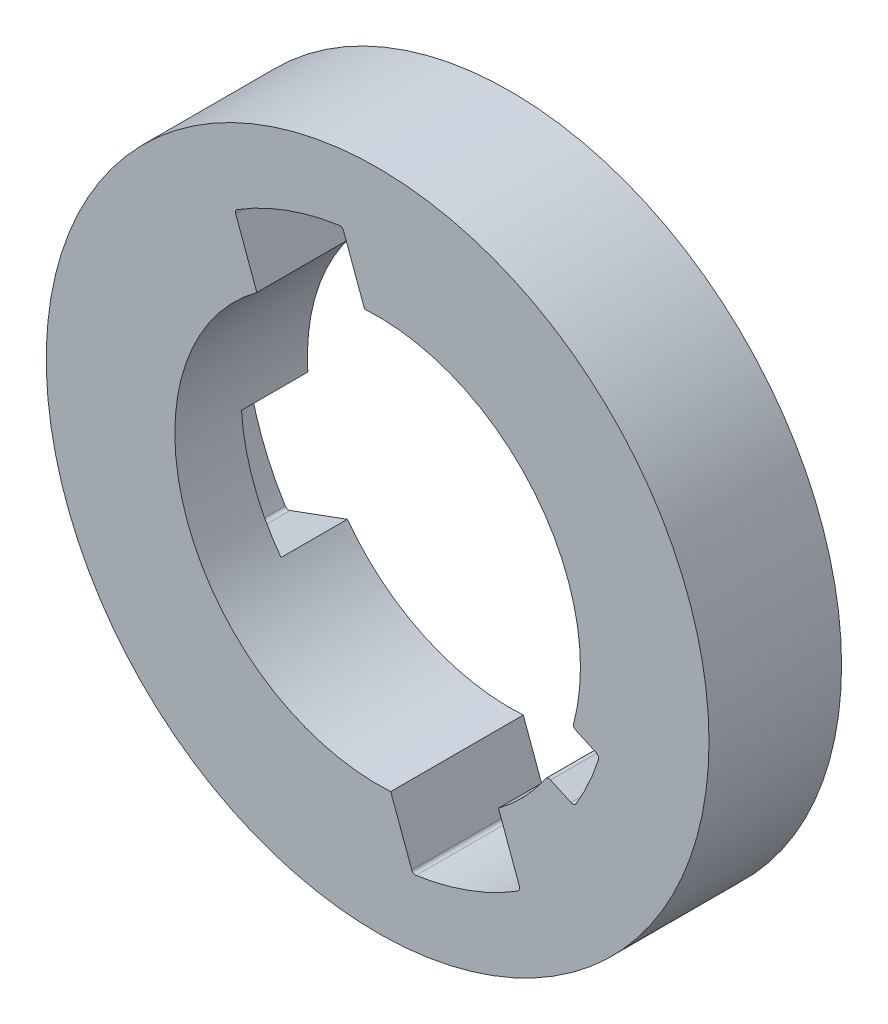
from build123d import *

# Parameters (mm, degrees)
ESQUISSE1_R             = 25
BOSS_EXTRU_1_DEPTH      = 10
ENL_V_MAT_EXTRU_1_DEPTH = 5


with BuildPart() as part:
    # Esquisse1 → Boss.-Extru.1 (new body)
    with BuildSketch(Plane.XY):
        Circle(ESQUISSE1_R)
        with BuildLine():
            ThreePointArc((14.787409001, -3.927153556), (14.806182583, -4.132467854), (14.953030626, -4.277181575))
            Line((14.953030626, -4.277181575), (16.501758042, -4.982426557))
            ThreePointArc((16.501758042, -4.982426557), (16.651785463, -5.134087079), (16.663083329, -5.347116418))
            ThreePointArc((16.663083329, -5.347116418), (15.924531384, -7.256672806), (14.968008895, -9.066901881))
            ThreePointArc((14.968008895, -9.066901881), (14.799864591, -9.198133844), (14.587009397, -9.184458985))
            Line((14.587009397, -9.184458985), (13.038282108, -8.478683252))
            ThreePointArc((13.038282108, -8.478683252), (12.832759155, -8.462847948), (12.665533258, -8.583371557))
            ThreePointArc((12.665533258, -8.583371557), (11.047050831, -10.585493278), (9.115784449, -12.28789949))
            Line((9.115784449, -12.28789949), (10.702270918, -16.615013469))
            ThreePointArc((10.702270918, -16.615013469), (10.704320991, -16.815778994), (10.57929488, -16.972876004))
            ThreePointArc((10.57929488, -16.972876004), (6.884626339, -18.777697414), (2.898945402, -19.788787622))
            ThreePointArc((2.898945402, -19.788787622), (2.70200379, -19.749736367), (2.57379576, -19.595225203))
            Line((2.57379576, -19.595225203), (0.987309291, -15.268111225))
            ThreePointArc((0.987309291, -15.268111225), (-14.364938522, -5.26673915), (-9.115784449, 12.28789949))
            Line((-9.115784449, 12.28789949), (-10.702270918, 16.615013469))
            ThreePointArc((-10.702270918, 16.615013469), (-10.704320991, 16.815778994), (-10.57929488, 16.972876004))
            ThreePointArc((-10.57929488, 16.972876004), (-6.884626339, 18.777697414), (-2.898945402, 19.788787622))
            ThreePointArc((-2.898945402, 19.788787622), (-2.70200379, 19.749736367), (-2.57379576, 19.595225203))
            Line((-2.57379576, 19.595225203), (-0.987309291, 15.268111225))
            ThreePointArc((-0.987309291, 15.268111225), (11.820542944, 9.714152794), (14.787409001, -3.927153556))
        make_face(mode=Mode.SUBTRACT)
    extrude(amount=BOSS_EXTRU_1_DEPTH)

    # Esquisse1<6> → Enlèv. mat.-Extru.1 (cut)
    with BuildSketch(Plane.XY):
        with BuildLine():
            ThreePointArc((12.28789949, 9.115784449), (14.364938522, 5.26673915), (15.268111225, 0.987309291))
            Line((15.268111225, 0.987309291), (19.595225203, 2.57379576))
            ThreePointArc((19.595225203, 2.57379576), (19.749736367, 2.70200379), (19.788787622, 2.898945402))
            ThreePointArc((19.788787622, 2.898945402), (18.777697414, 6.884626339), (16.972876004, 10.57929488))
            ThreePointArc((16.972876004, 10.57929488), (16.815778994, 10.704320991), (16.615013469, 10.702270918))
            Line((16.615013469, 10.702270918), (12.28789949, 9.115784449))
        make_face()
        with BuildLine():
            ThreePointArc((-12.28789949, -9.115784449), (-14.364938522, -5.26673915), (-15.268111225, -0.987309291))
            Line((-15.268111225, -0.987309291), (-19.595225203, -2.57379576))
            ThreePointArc((-19.595225203, -2.57379576), (-19.749736367, -2.70200379), (-19.788787622, -2.898945402))
            ThreePointArc((-19.788787622, -2.898945402), (-18.777697414, -6.884626339), (-16.972876004, -10.57929488))
            ThreePointArc((-16.972876004, -10.57929488), (-16.815778994, -10.704320991), (-16.615013469, -10.702270918))
            Line((-16.615013469, -10.702270918), (-12.28789949, -9.115784449))
        make_face()
    extrude(amount=ENL_V_MAT_EXTRU_1_DEPTH, mode=Mode.SUBTRACT)


solid = part.part
